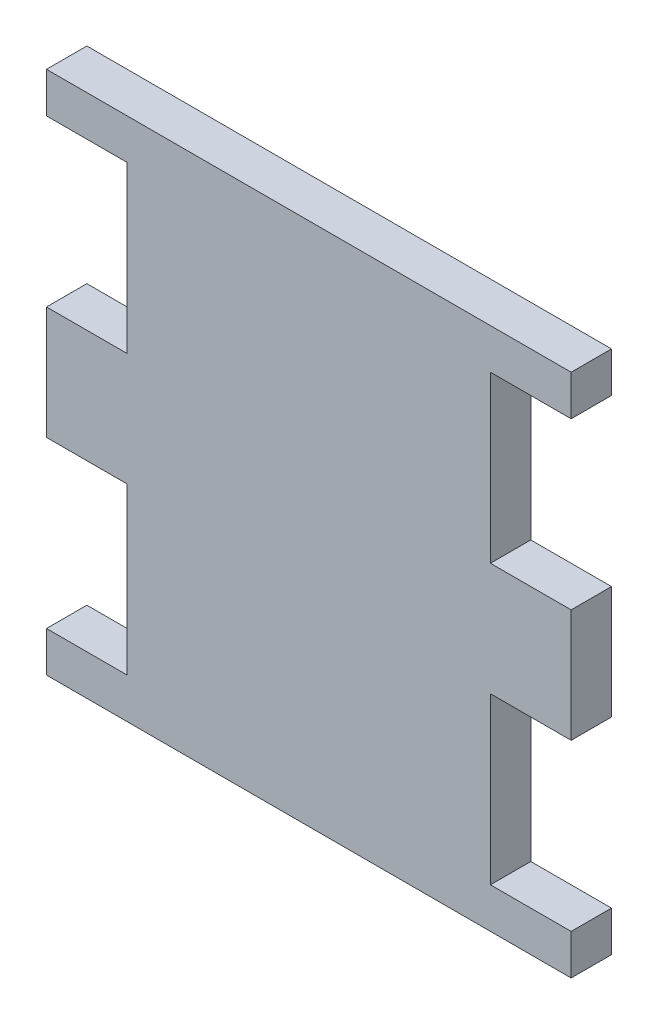
from build123d import *

# Parameters (mm, degrees)
ESQUISSE1_W             = 130
ESQUISSE1_H             = 130
BOSS_EXTRU_1_DEPTH      = 10
ESQUISSE2_W             = 20
ESQUISSE2_H             = 41
ENL_V_MAT_EXTRU_1_DEPTH = 10


with BuildPart() as part:
    # Esquisse1 → Boss.-Extru.1 (new body)
    with BuildSketch(Plane.XY):
        with Locations((65, -65)):
            Rectangle(ESQUISSE1_W, ESQUISSE1_H)
    extrude(amount=BOSS_EXTRU_1_DEPTH)

    # Esquisse2 → Enlèv. mat.-Extru.1 (cut)
    with BuildSketch(Plane.XY.offset(10)):
        with Locations((10, -30.5)):
            Rectangle(ESQUISSE2_W, ESQUISSE2_H)
        with Locations((10, -99.5)):
            Rectangle(ESQUISSE2_W, ESQUISSE2_H)
        with Locations((120, -30.5)):
            Rectangle(ESQUISSE2_W, ESQUISSE2_H)
        with Locations((120, -99.5)):
            Rectangle(ESQUISSE2_W, ESQUISSE2_H)
    extrude(amount=-ENL_V_MAT_EXTRU_1_DEPTH, mode=Mode.SUBTRACT)


solid = part.part
